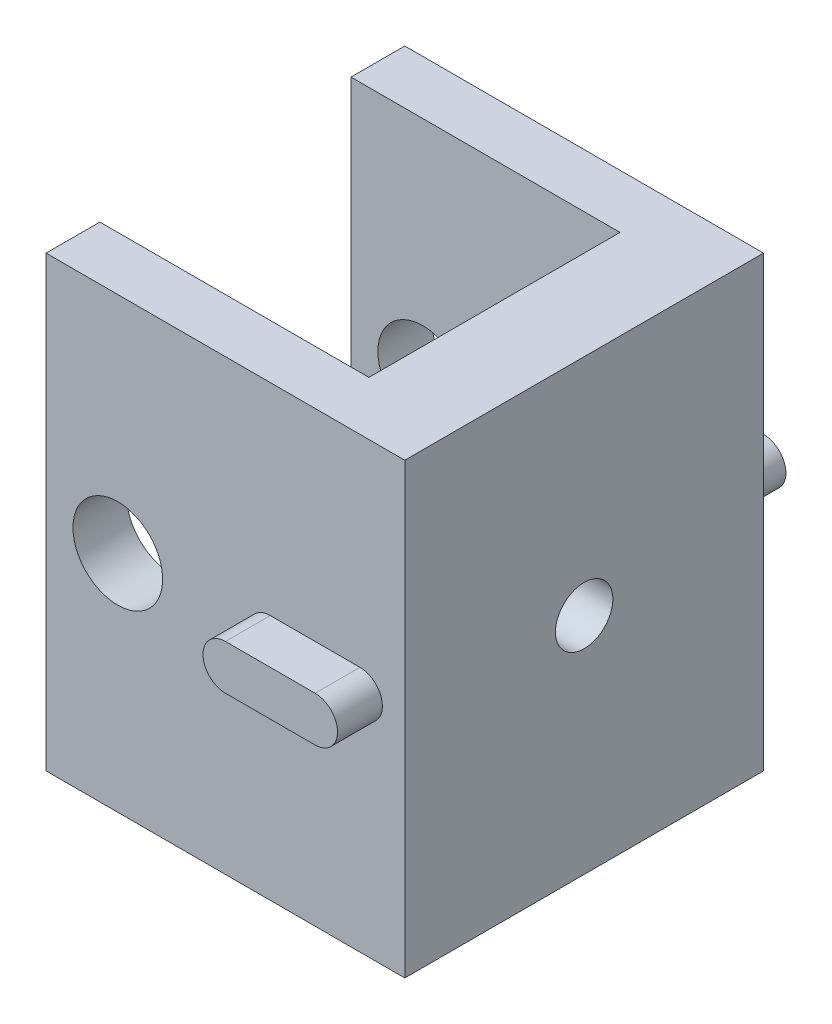
from build123d import *

# Parameters (mm, degrees)
EXTRUDE_1_DEPTH     = 25
CUT_EXTRUDE_1_DEPTH = 2.5
SKETCH_3_R          = 1.6
CUT_EXTRUDE_2_DEPTH = 2.5
EXTRUDE_2_DEPTH     = 2.5
SKETCH_5_R          = 2.5
CUT_EXTRUDE_3_DEPTH = 37.827299657


with BuildPart() as part:
    # Эскиз1 → Бобышка-Вытянуть1 (new body)
    with BuildSketch(Plane(origin=(0, 0, 0), x_dir=(1, 0, 0), z_dir=(0, 1, 0))):
        Polygon((0, 7), (0, -7), (-15, -7), (-15, -10), (5, -10), (5, 10), (-15, 10), (-15, 7), align=None)
    extrude(amount=EXTRUDE_1_DEPTH)

    # Эскиз2 → Вырез-Вытянуть1 (cut)
    with BuildSketch(Plane.ZY):
        Polygon((3, 14.232050808), (0, 15.964101615), (-3, 14.232050808), (-3, 10.767949192), (0, 9.035898385), (3, 10.767949192), align=None)
    extrude(amount=-CUT_EXTRUDE_1_DEPTH, mode=Mode.SUBTRACT)

    # Эскиз3 → Вырез-Вытянуть2 (cut)
    with BuildSketch(Plane.ZY.offset(-2.5)):
        with Locations((0, 12.5)):
            Circle(SKETCH_3_R)
    extrude(amount=-CUT_EXTRUDE_2_DEPTH, mode=Mode.SUBTRACT)

    # Эскиз4 → Бобышка-Вытянуть2 (add)
    with BuildSketch(Plane(origin=(0, 0, -10), x_dir=(-1, 0, 0), z_dir=(0, 0, -1))):
        with BuildLine():
            Line((-2.5, 13.75), (2.5, 13.75))
            ThreePointArc((2.5, 13.75), (3.75, 12.5), (2.5, 11.25))
            Line((2.5, 11.25), (-2.5, 11.25))
            ThreePointArc((-2.5, 11.25), (-3.75, 12.5), (-2.5, 13.75))
        make_face()
    extrude_2 = extrude(amount=EXTRUDE_2_DEPTH)

    # Зеркальное отражение1: Бобышка-Вытянуть2 across plane
    add(extrude_2.mirror(Plane(origin=(0, 0, 0), x_dir=(1, 0, 0), z_dir=(0, 0, -1))))

    # Эскиз5 → Вырез-Вытянуть3 (cut, through all)
    with BuildSketch(Plane(origin=(0, 0, -10), x_dir=(-1, 0, 0), z_dir=(0, 0, -1))):
        with Locations((11, 12.5)):
            Circle(SKETCH_5_R)
    extrude(amount=-CUT_EXTRUDE_3_DEPTH, mode=Mode.SUBTRACT)


solid = part.part
